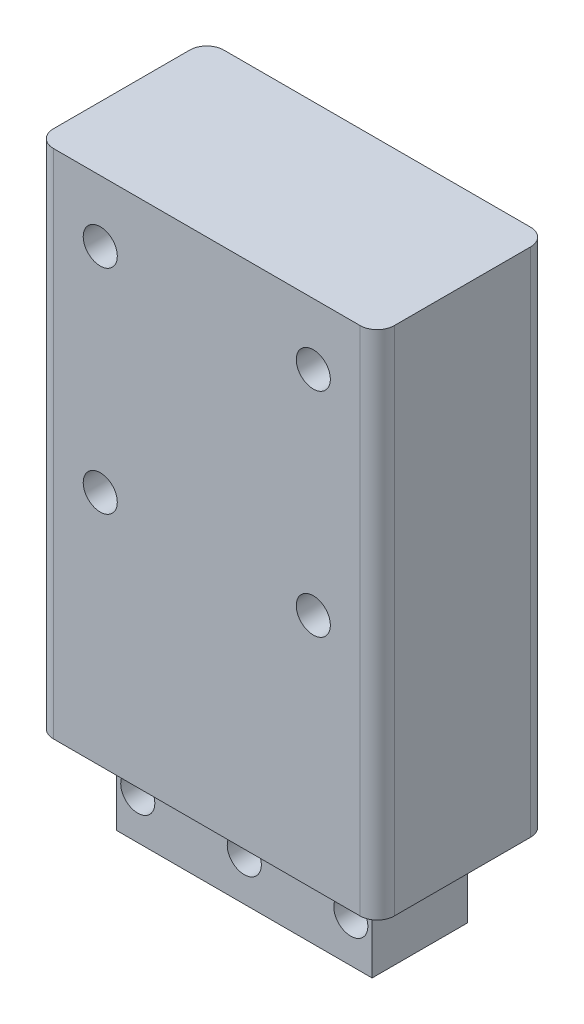
from build123d import *

# Parameters (mm, degrees)
SKETCH1_W           = 40
SKETCH1_H           = 20
BOSS_EXTRUDE1_DEPTH = 20
SKETCH3_W           = 40
SKETCH3_H           = 20
BOSS_EXTRUDE2_DEPTH = 40
SKETCH4_W           = 30
SKETCH4_H           = 11.2
BOSS_EXTRUDE3_DEPTH = 10
SKETCH5_R           = 2
CUT_EXTRUDE1_DEPTH  = 35
SKETCH6_R           = 2
CUT_EXTRUDE2_DEPTH  = 35
FILLET2_R           = 2


with BuildPart() as part:
    # Sketch1 → Boss-Extrude1 (new body)
    with BuildSketch(Plane(origin=(0, 0, 0), x_dir=(1, 0, 0), z_dir=(0, 1, 0))):
        Rectangle(SKETCH1_W, SKETCH1_H)
    extrude(amount=-BOSS_EXTRUDE1_DEPTH)

    # Sketch3 → Boss-Extrude2 (add)
    with BuildSketch(Plane(origin=(0, 0, 0), x_dir=(1, 0, 0), z_dir=(0, 1, 0))):
        Rectangle(SKETCH3_W, SKETCH3_H)
    extrude(amount=BOSS_EXTRUDE2_DEPTH)

    # Sketch4 → Boss-Extrude3 (add)
    with BuildSketch(Plane.XZ.offset(20)):
        Rectangle(SKETCH4_W, SKETCH4_H)
    extrude(amount=BOSS_EXTRUDE3_DEPTH)

    # Sketch5 → Cut-Extrude1 (cut, symmetric)
    with BuildSketch(Plane(origin=(0, 0, -5.6), x_dir=(-1, 0, 0), z_dir=(0, 0, -1))):
        with Locations((0, -25)):
            Circle(SKETCH5_R)
        with Locations((12.5, -25)):
            Circle(SKETCH5_R)
        with Locations((-12.5, -25)):
            Circle(SKETCH5_R)
    extrude(amount=CUT_EXTRUDE1_DEPTH, both=True, mode=Mode.SUBTRACT)

    # Sketch6 → Cut-Extrude2 (cut)
    with BuildSketch(Plane(origin=(0, 0, -10), x_dir=(-1, 0, 0), z_dir=(0, 0, -1))):
        with Locations((12.5, 7.800844988)):
            Circle(SKETCH6_R)
        with Locations((12.5, 32.800844988)):
            Circle(SKETCH6_R)
        with Locations(Location((-12.5, 32.800844988, 0), (0, 0, 180))):
            Circle(SKETCH6_R)
        with Locations(Location((-12.5, 7.800844988, 0), (0, 0, 180))):
            Circle(SKETCH6_R)
    extrude(amount=-CUT_EXTRUDE2_DEPTH, mode=Mode.SUBTRACT)

    # Fillet2
    fillet2_edges = [part.edges().sort_by_distance(p)[0] for p in [
        (-20, 10, -10),
        (20, 10, -10),
        (20, 10, 10),
        (-20, 10, 10),
    ]]
    fillet(fillet2_edges, radius=FILLET2_R)


solid = part.part
